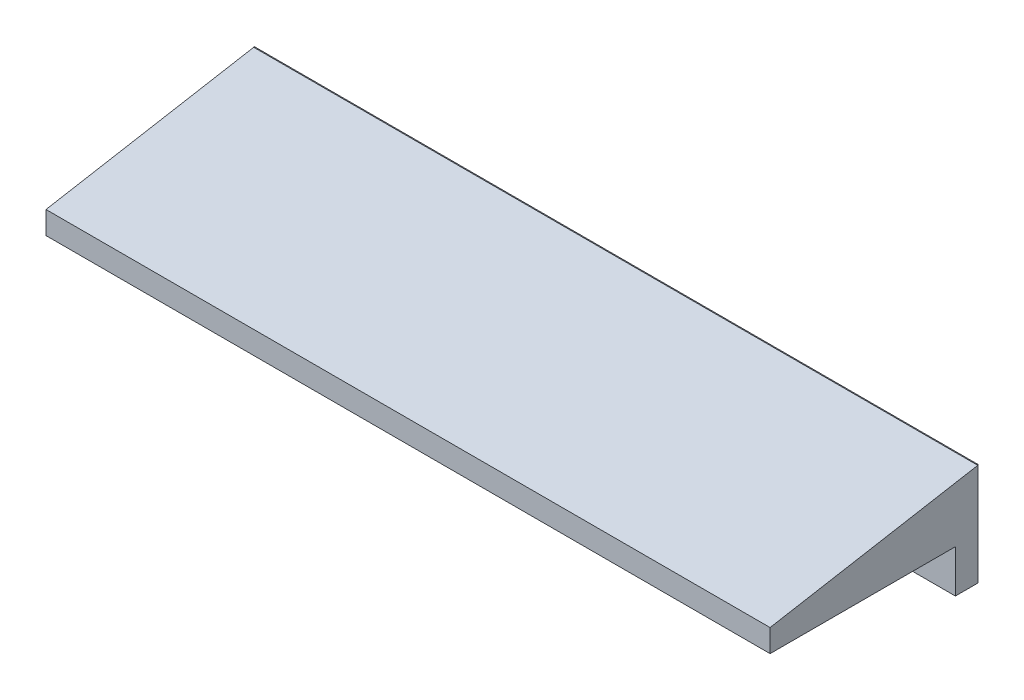
from build123d import *

# Parameters (mm, degrees)
SKETCH1_W           = 101.6
SKETCH1_H           = 26
BOSS_EXTRUDE1_DEPTH = 3.175
SKETCH2_W           = 101.6
SKETCH2_H           = 9.175
BOSS_EXTRUDE2_DEPTH = 3.175
SKETCH3_R           = 1.6
CUT_EXTRUDE1_DEPTH  = 3.175
BOSS_EXTRUDE3_DEPTH = 101.6


with BuildPart() as part:
    # Sketch1 → Boss-Extrude1 (new body)
    with BuildSketch(Plane(origin=(0, 0, 0), x_dir=(1, 0, 0), z_dir=(0, 1, 0))):
        Rectangle(SKETCH1_W, SKETCH1_H)
    extrude(amount=BOSS_EXTRUDE1_DEPTH)

    # Sketch2 → Boss-Extrude2 (add)
    with BuildSketch(Plane(origin=(0, 0, -13), x_dir=(-1, 0, 0), z_dir=(0, 0, -1))):
        with Locations((0, -1.4125)):
            Rectangle(SKETCH2_W, SKETCH2_H)
    extrude(amount=BOSS_EXTRUDE2_DEPTH)

    # Sketch3 → Cut-Extrude1 (cut)
    with BuildSketch(Plane.XY.offset(-13)):
        with Locations((30.3075, -3)):
            Circle(SKETCH3_R)
        with Locations((-30.3075, -3)):
            Circle(SKETCH3_R)
        with Locations((43.9685, -3)):
            Circle(SKETCH3_R)
        with Locations((-43.9685, -3)):
            Circle(SKETCH3_R)
    extrude(amount=-CUT_EXTRUDE1_DEPTH, mode=Mode.SUBTRACT)

    # Sketch4 → Boss-Extrude3 (add)
    with BuildSketch(Plane(origin=(50.8, 0, 0), x_dir=(0, 0, -1), z_dir=(1, 0, 0))):
        Polygon((16.175, 3.175), (16.175, 8.412812241), (16.143192443, 8.313731132), (-13, 3.175), align=None)
    extrude(amount=-BOSS_EXTRUDE3_DEPTH)


solid = part.part
